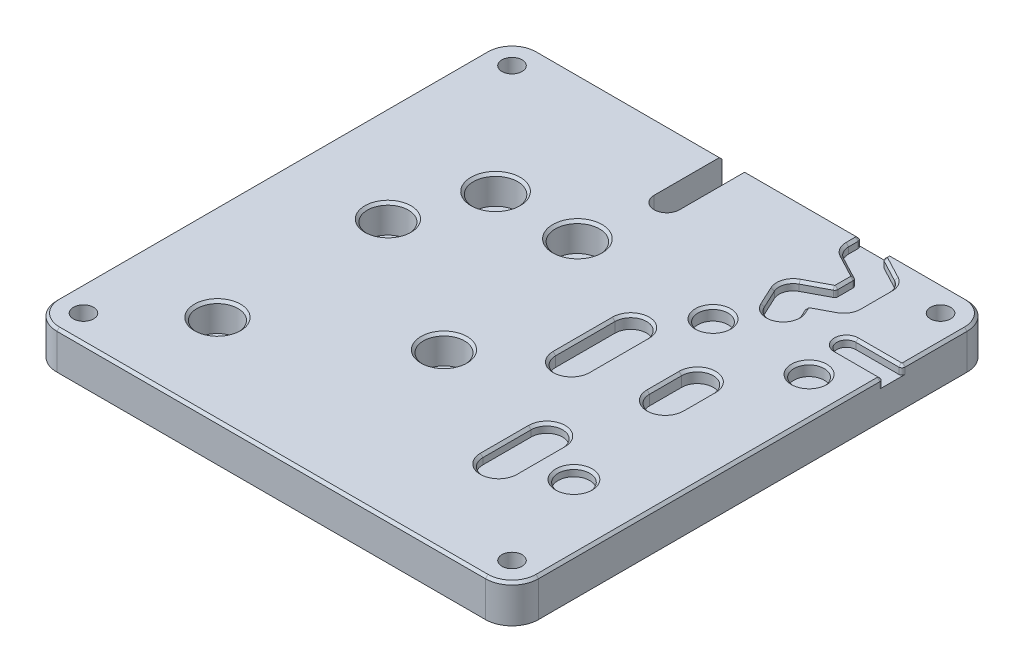
from build123d import *

# Parameters (mm, degrees)
BASE_PLATE_R        = 1.6
EXTRUDE_1_DEPTH     = 6
CUT_EXTRUDE_START   = -6
SKETCH_1_R          = 3.25
SKETCH_1_R_2        = 3.5
CUT_EXTRUDE_1_DEPTH = 4.5
SKETCH_1_6_R        = 2.4
CUT_EXTRUDE_2_DEPTH = 2
SKETCH_1_7_R        = 2.5
CUT_EXTRUDE_3_DEPTH = 1.4
FILLET_2_R          = 0.5
CHAMFER_1_SIZE      = 0.4


with BuildPart() as part:
    # Base plate → 凸台-拉伸1 (new body)
    with BuildSketch(Plane(origin=(0, 0, 0), x_dir=(1, 0, 0), z_dir=(0, 1, 0))):
        with BuildLine():
            ThreePointArc((-38.1, -33.9), (-36.869848481, -36.869848481), (-33.9, -38.1))
            Line((-33.9, -38.1), (33.9, -38.1))
            ThreePointArc((33.9, -38.1), (36.869848481, -36.869848481), (38.1, -33.9))
            Line((38.1, -33.9), (38.1, 33.9))
            ThreePointArc((38.1, 33.9), (36.869848481, 36.869848481), (33.9, 38.1))
            Line((33.9, 38.1), (-0.9, 38.1))
            Line((-0.9, 38.1), (-0.9, 27.4))
            ThreePointArc((-0.9, 27.4), (-2.9, 25.4), (-4.9, 27.4))
            Line((-4.9, 27.4), (-4.9, 38.1))
            Line((-4.9, 38.1), (-33.9, 38.1))
            ThreePointArc((-33.9, 38.1), (-36.869848481, 36.869848481), (-38.1, 33.9))
            Line((-38.1, 33.9), (-38.1, -33.9))
        make_face()
        with Locations(Location((-33.9, -33.9, 0), (0, 0, 270))):
            Circle(BASE_PLATE_R, mode=Mode.SUBTRACT)
        with Locations(Location((33.9, -33.9, 0), (0, 0, 270))):
            Circle(BASE_PLATE_R, mode=Mode.SUBTRACT)
        with Locations(Location((-33.9, 33.9, 0), (0, 0, 270))):
            Circle(BASE_PLATE_R, mode=Mode.SUBTRACT)
        with Locations(Location((33.9, 33.9, 0), (0, 0, 270))):
            Circle(BASE_PLATE_R, mode=Mode.SUBTRACT)
    extrude(amount=EXTRUDE_1_DEPTH)

    # 草图1 → 切除-拉伸1 (cut)
    with BuildSketch(Plane.XZ.offset(CUT_EXTRUDE_START)):
        with Locations(Location((-0.35, 10.415, 0), (0, 0, 90))):
            Circle(SKETCH_1_R)
        with Locations(Location((-22.7, 23.9, 0), (0, 0, 90))):
            Circle(SKETCH_1_R)
        with Locations(Location((-22.7, -3.07, 0), (0, 0, 90))):
            Circle(SKETCH_1_R)
        with Locations(Location((-17.96, -15.36, 0), (0, 0, 90))):
            Circle(SKETCH_1_R_2)
        with Locations(Location((-5.01, -15.36, 0), (0, 0, 90))):
            Circle(SKETCH_1_R_2)
    extrude(amount=CUT_EXTRUDE_1_DEPTH, mode=Mode.SUBTRACT)

    # 草图1<6> → 切除-拉伸2 (cut)
    with BuildSketch(Plane.XZ.offset(CUT_EXTRUDE_START)):
        with BuildLine():
            Line((8.9, 2), (8.9, -7.4))
            ThreePointArc((8.9, -7.4), (11.4, -9.9), (13.9, -7.4))
            Line((13.9, -7.4), (13.9, 2))
            ThreePointArc((13.9, 2), (11.4, 4.5), (8.9, 2))
        make_face()
        with BuildLine():
            Line((21.6, -0.16), (21.6, -5.24))
            ThreePointArc((21.6, -5.24), (24.1, -7.74), (26.6, -5.24))
            Line((26.6, -5.24), (26.6, -0.16))
            ThreePointArc((26.6, -0.16), (24.1, 2.34), (21.6, -0.16))
        make_face()
        with Locations(Location((31.9, -15.1, 0), (0, 0, 90))):
            Circle(SKETCH_1_6_R)
        with Locations(Location((16.7, -15.1, 0), (0, 0, 90))):
            Circle(SKETCH_1_6_R)
    extrude(amount=CUT_EXTRUDE_2_DEPTH, mode=Mode.SUBTRACT)

    # 草图1<7> → 切除-拉伸3 (cut)
    with BuildSketch(Plane.XZ.offset(CUT_EXTRUDE_START)):
        with BuildLine():
            Line((21.65, -38.1), (21.65, -37.1))
            Line((21.65, -37.1), (21.65, -36.1))
            ThreePointArc((21.65, -36.1), (20.560909108, -34.172620939), (18.347964405, -34.111100529))
            ThreePointArc((18.347964405, -34.111100529), (17.472620939, -34.939090892), (17.15, -36.1))
            Line((17.15, -36.1), (17.15, -38.1))
            Line((17.15, -38.1), (21.65, -38.1))
        make_face()
        with BuildLine():
            Line((21.65, -37.1), (25.452035595, -35.088899471))
            ThreePointArc((25.452035595, -35.088899471), (23.239090892, -35.027379061), (22.15, -33.1))
            Line((22.15, -33.1), (22.15, -32.1))
            Line((22.15, -32.1), (18.347964405, -34.111100529))
            ThreePointArc((18.347964405, -34.111100529), (20.560909108, -34.172620939), (21.65, -36.1))
            Line((21.65, -36.1), (21.65, -37.1))
        make_face()
        with BuildLine():
            ThreePointArc((22.15, -33.1), (24.4, -35.35), (26.65, -33.1))
            Line((26.65, -33.1), (26.65, -28.1))
            ThreePointArc((26.65, -28.1), (24.4, -25.85), (22.15, -28.1))
            Line((22.15, -28.1), (22.15, -33.1))
        make_face()
        with BuildLine():
            ThreePointArc((22.15, -28.1), (23.239090892, -26.172620939), (25.452035595, -26.111100529))
            Line((25.452035595, -26.111100529), (22.211102988, -24.396797462))
            Line((22.211102988, -24.396797462), (21.438912065, -26.051492297))
            ThreePointArc((21.438912065, -26.051492297), (20.115915291, -27.233064766), (18.347964405, -27.088899471))
            Line((18.347964405, -27.088899471), (22.15, -29.1))
            Line((22.15, -29.1), (22.15, -28.1))
        make_face()
        with BuildLine():
            Line((18.761087935, -21.148507703), (17.361087935, -24.148507703))
            ThreePointArc((17.361087935, -24.148507703), (18.448507703, -27.138912065), (21.438912065, -26.051492297))
            Line((21.438912065, -26.051492297), (22.838912065, -23.051492297))
            ThreePointArc((22.838912065, -23.051492297), (21.751492297, -20.061087935), (18.761087935, -21.148507703))
        make_face()
        with BuildLine():
            Line((38.1, -20.6), (30.8, -20.6))
            ThreePointArc((30.8, -20.6), (29.3, -22.1), (30.8, -23.6))
            Line((30.8, -23.6), (38.1, -23.6))
            Line((38.1, -23.6), (38.1, -20.6))
        make_face()
        with BuildLine():
            Line((17.1, 21.71), (17.1, 14.09))
            ThreePointArc((17.1, 14.09), (19.6, 11.59), (22.1, 14.09))
            Line((22.1, 14.09), (22.1, 21.71))
            ThreePointArc((22.1, 21.71), (19.6, 24.21), (17.1, 21.71))
        make_face()
        with Locations(Location((27.7, 17.9, 0), (0, 0, 90))):
            Circle(SKETCH_1_7_R)
    extrude(amount=CUT_EXTRUDE_3_DEPTH, mode=Mode.SUBTRACT)

    # 圆角2
    fillet_2_edges = [part.edges().sort_by_distance(p)[0] for p in [
        (38.1, 5.3, -23.6),
        (38.1, 5.3, -20.6),
        (21.65, 5.3, -38.1),
        (21.65, 5.3, -37.1),
        (22.211102988, 5.3, -24.396797462),
        (22.15, 5.3, -29.1),
        (22.15, 5.3, -32.1),
        (17.15, 5.3, -38.1),
    ]]
    fillet(fillet_2_edges, radius=FILLET_2_R)

    # 倒角1
    chamfer_1_edges = [part.edges().sort_by_distance(p)[0] for p in [
        (29.3, 6, -22.1),
        (22.1, 6, 17.9),
        (19.6, 6, 11.59),
        (17.1, 6, 17.9),
        (19.6, 6, 24.21),
        (27.7, 6, 15.4),
        (26.65, 6, -30.6),
        (17.472620939, 6, -34.939090892),
        (17.266935234, 6, -25.815915291),
        (18.061087935, 6, -22.648507703),
        (21.751492297, 6, -20.061087935),
        (26.327379061, 6, -26.939090892),
        (26.327379061, 6, -34.260909108),
        (28.025, 6, -38.1),
        (34.2, 6, -20.6),
        (34.2, 6, -23.6),
        (38.1, 6, -29),
        (21.65, 6, -37.500581317),
        (23.684124954, 6, -36.024042222),
        (24.041794054, 6, -25.365148146),
        (22.625579348, 6, -23.508633834),
        (20.115875046, 6, -28.024042222),
        (22.15, 6, -30.6),
        (20.115875046, 6, -33.175957778),
        (17.15, 6, -36.85),
        (22.391323808, 6, -24.336310391),
        (22.078306458, 6, -29.143182832),
        (22.078306458, 6, -32.056817168),
        (21.721693542, 6, -37.143182832),
        (37.953553391, 6, -20.453553391),
        (37.953553391, 6, -23.746446609),
        (17.003553391, 6, -37.953553391),
        (21.796446609, 6, -37.953553391),
        (-19.4, 6, -38.1),
        (-36.869848481, 6, -36.869848481),
        (-38.1, 6, 0),
        (-36.869848481, 6, 36.869848481),
        (0, 6, 38.1),
        (36.869848481, 6, 36.869848481),
        (38.1, 6, 6.9),
        (36.869848481, 6, -36.869848481),
        (-5.01, 6, -18.86),
        (-17.96, 6, -18.86),
        (-22.7, 6, -6.32),
        (7.875, 6, -38.1),
        (-22.7, 6, 20.65),
        (-0.35, 6, 7.165),
        (13.9, 6, -2.7),
        (11.4, 6, -9.9),
        (8.9, 6, -2.7),
        (11.4, 6, 4.5),
        (26.6, 6, -2.7),
        (24.1, 6, -7.74),
        (21.6, 6, -2.7),
        (24.1, 6, 2.34),
        (31.9, 6, -17.5),
        (16.7, 6, -17.5),
    ]]
    chamfer(chamfer_1_edges, length=CHAMFER_1_SIZE)


solid = part.part
